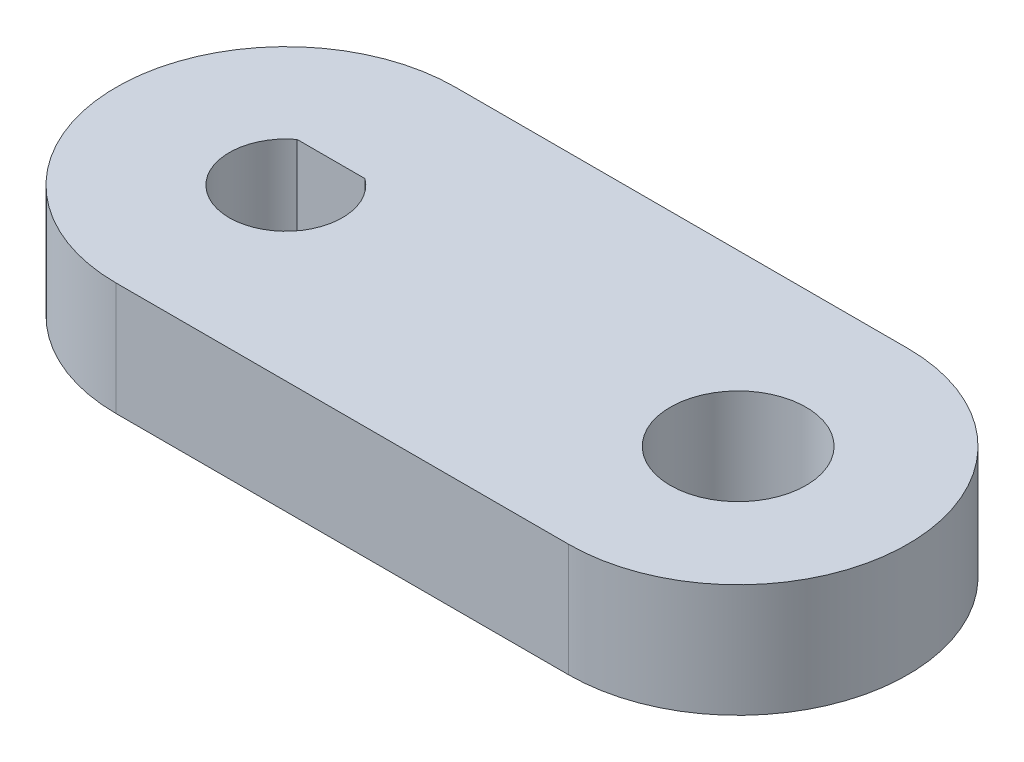
from build123d import *

# Parameters (mm, degrees)
SKETCH1_R           = 3
BOSS_EXTRUDE1_DEPTH = 5


with BuildPart() as part:
    # Sketch1 → Boss-Extrude1 (new body)
    with BuildSketch(Plane(origin=(0, 0, 0), x_dir=(1, 0, 0), z_dir=(0, 1, 0))):
        with BuildLine():
            Line((0, 7.5), (20, 7.5))
            ThreePointArc((20, 7.5), (27.5, 0), (20, -7.5))
            Line((20, -7.5), (0, -7.5))
            ThreePointArc((0, -7.5), (-7.5, 0), (0, 7.5))
        make_face()
        with Locations(Location((20, 0, 0), (0, 0, 270))):
            Circle(SKETCH1_R, mode=Mode.SUBTRACT)
        with BuildLine():
            Line((1.5, 2), (-1.5, 2))
            ThreePointArc((-1.5, 2), (0, -2.5), (1.5, 2))
        make_face(mode=Mode.SUBTRACT)
    extrude(amount=BOSS_EXTRUDE1_DEPTH)


solid = part.part
